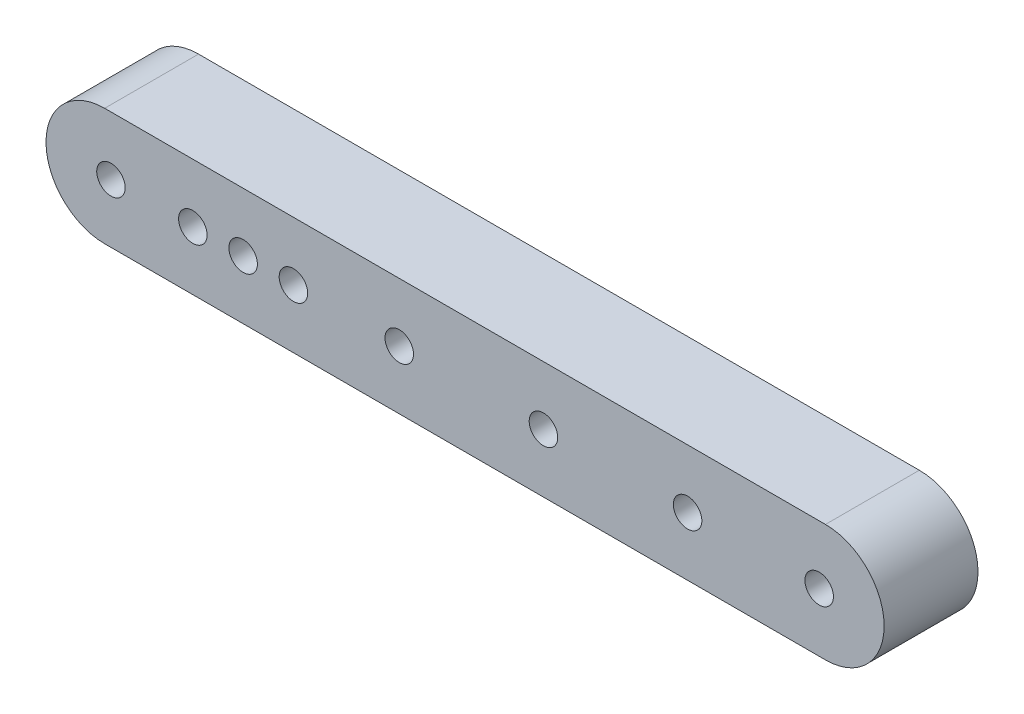
from build123d import *

# Parameters (mm, degrees)
BOSS_EXTRUDE1_DEPTH      = 2.8
BOSS_EXTRUDE1_DEPTH_BACK = 2.8
ECHELLE1_SCALE           = 2
SKETCH2_R                = 1.7
CUT_EXTRUDE6_DEPTH       = 11.2


with BuildPart() as part:
    # Sketch1 → Boss-Extrude1 (new, two sides: drawn at the far end of the back side and taken through both)
    with BuildSketch(Plane.XY.offset(-BOSS_EXTRUDE1_DEPTH_BACK)):
        with BuildLine():
            Line((-33.309608541, 3.5), (9.690391459, 3.5))
            ThreePointArc((9.690391459, 3.5), (13.190391459, 0), (9.690391459, -3.5))
            Line((9.690391459, -3.5), (-33.309608541, -3.5))
            ThreePointArc((-33.309608541, -3.5), (-36.809608541, 0), (-33.309608541, 3.5))
        make_face()
    extrude(amount=BOSS_EXTRUDE1_DEPTH + BOSS_EXTRUDE1_DEPTH_BACK)


with BuildPart() as part_1:
    # Echelle1: scaled about (-11.809608541, 0, 0)
    add(part.part.scale(ECHELLE1_SCALE).moved(Location((11.809608541, 0, 0))))

    # Sketch2 → Cut-Extrude6 (cut)
    with BuildSketch(Plane.XY.offset(-5.6)):
        with Locations((-38.289608541, 0)):
            Circle(SKETCH2_R)
        with Locations((-54.059608541, 0)):
            Circle(SKETCH2_R)
        with Locations((-19.659608541, 0)):
            Circle(SKETCH2_R)
        with Locations((-2.459608541, 0)):
            Circle(SKETCH2_R)
        with Locations((14.740391459, 0)):
            Circle(SKETCH2_R)
        with Locations((-44.289608541, 0)):
            Circle(SKETCH2_R)
        with Locations((-32.289608541, 0)):
            Circle(SKETCH2_R)
        with Locations((30.440391459, 0)):
            Circle(SKETCH2_R)
    extrude(amount=CUT_EXTRUDE6_DEPTH, mode=Mode.SUBTRACT)


solid = part_1.part
